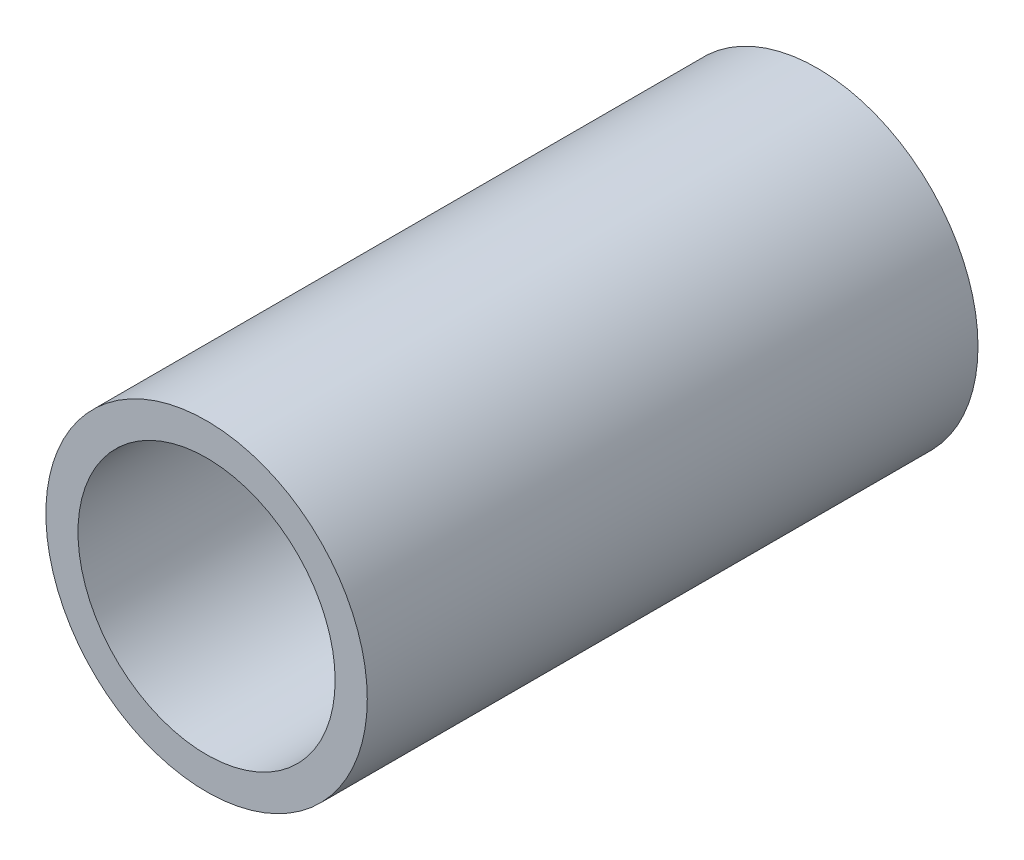
from build123d import *

# Parameters (mm, degrees)
SKETCH_1_R      = 5
SKETCH_1_R_2    = 4
EXTRUDE_1_DEPTH = 19


with BuildPart() as part:
    # 스케치1 → 보스-돌출1 (new body)
    with BuildSketch(Plane.XY):
        Circle(SKETCH_1_R)
        Circle(SKETCH_1_R_2, mode=Mode.SUBTRACT)
    extrude(amount=EXTRUDE_1_DEPTH)


solid = part.part
